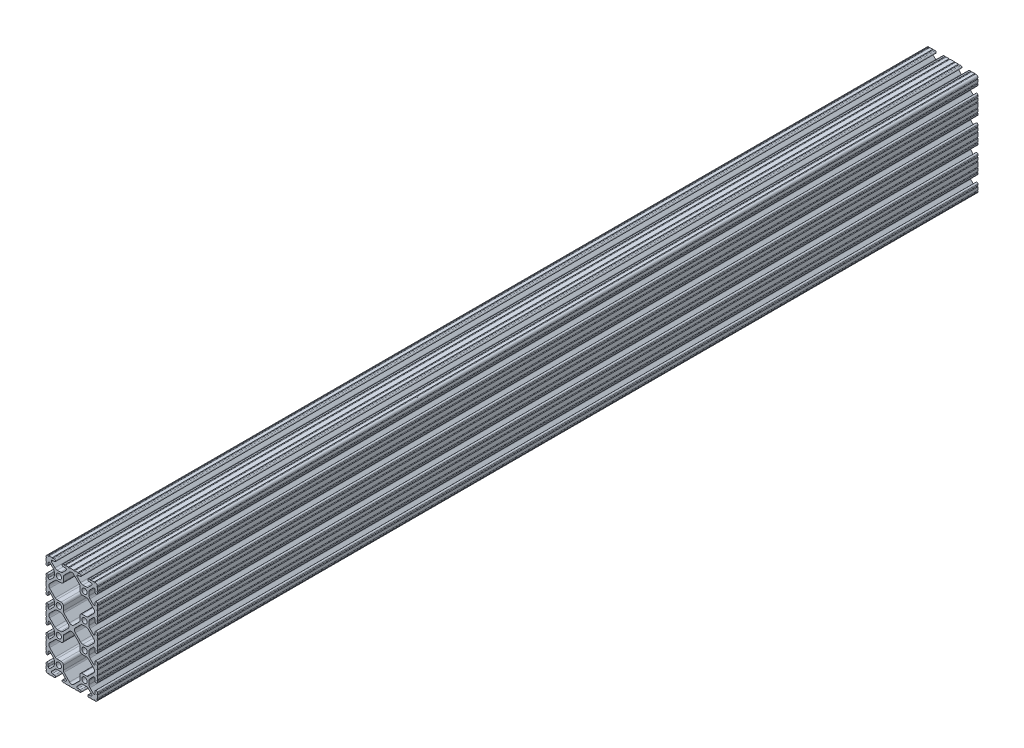
from build123d import *

# Parameters (mm, degrees)
SKETCH1_R      = 2.6035
EXTRUDE1_DEPTH = 871.728


with BuildPart() as part:
    # Sketch1 → Extrude1 (new body)
    with BuildSketch(Plane.XY):
        with BuildLine():
            Line((-12.699984366, 40.2336), (-12.699984366, 35.9664))
            ThreePointArc((-12.699984366, 35.9664), (-12.192, 35.458392183), (-12.7, 34.9504))
            Line((-12.7, 34.9504), (-12.7, 32.004))
            ThreePointArc((-12.7, 32.004), (-12.192, 31.496), (-12.7, 30.988))
            Line((-12.7, 30.988), (-12.7, 29.7434))
            ThreePointArc((-12.7, 29.7434), (-11.5951, 28.6385), (-10.4902, 29.7434))
            Line((-10.4902, 29.7434), (-10.4902, 31.874256981))
            ThreePointArc((-10.4902, 31.874256981), (-9.863010627, 32.812916821), (-8.755786031, 32.592683991))
            Line((-8.755786031, 32.592683991), (-5.425756348, 29.262714761))
            ThreePointArc((-5.425756348, 29.262714761), (-4.737487999, 28.232663563), (-4.4958, 27.017630353))
            Line((-4.4958, 27.017630353), (-4.4958, 23.782369647))
            ThreePointArc((-4.4958, 23.782369647), (-4.737487999, 22.567336437), (-5.425756348, 21.537285239))
            Line((-5.425756348, 21.537285239), (-8.755786031, 18.207316009))
            ThreePointArc((-8.755786031, 18.207316009), (-9.863010627, 17.987083179), (-10.4902, 18.925743019))
            Line((-10.4902, 18.925743019), (-10.4902, 21.0566))
            ThreePointArc((-10.4902, 21.0566), (-11.5951, 22.1615), (-12.7, 21.0566))
            Line((-12.7, 21.0566), (-12.7, 19.812))
            ThreePointArc((-12.7, 19.812), (-12.192, 19.304), (-12.7, 18.796))
            Line((-12.7, 18.796), (-12.7, 15.8496))
            ThreePointArc((-12.7, 15.8496), (-12.192, 15.341607817), (-12.699984366, 14.8336))
            Line((-12.699984366, 14.8336), (-12.699984366, 10.5664))
            ThreePointArc((-12.699984366, 10.5664), (-12.192, 10.0584), (-12.699984366, 9.5504))
            Line((-12.699984366, 9.5504), (-12.699984366, 6.604))
            ThreePointArc((-12.699984366, 6.604), (-12.192, 6.095992183), (-12.7, 5.588))
            Line((-12.7, 5.588), (-12.7, 4.3434))
            ThreePointArc((-12.7, 4.3434), (-11.5951, 3.2385), (-10.4902, 4.3434))
            Line((-10.4902, 4.3434), (-10.4902, 6.474256981))
            ThreePointArc((-10.4902, 6.474256981), (-9.863010627, 7.412916821), (-8.755786031, 7.192683991))
            Line((-8.755786031, 7.192683991), (-5.425756348, 3.862714761))
            ThreePointArc((-5.425756348, 3.862714761), (-4.737487999, 2.832663563), (-4.4958, 1.617630353))
            Line((-4.4958, 1.617630353), (-4.4958, -1.617630353))
            ThreePointArc((-4.4958, -1.617630353), (-4.737487999, -2.832663563), (-5.425756348, -3.862714761))
            Line((-5.425756348, -3.862714761), (-8.755786031, -7.192683991))
            ThreePointArc((-8.755786031, -7.192683991), (-9.863010627, -7.412916821), (-10.4902, -6.474256981))
            Line((-10.4902, -6.474256981), (-10.4902, -4.3434))
            ThreePointArc((-10.4902, -4.3434), (-11.5951, -3.2385), (-12.7, -4.3434))
            Line((-12.7, -4.3434), (-12.7, -5.588))
            ThreePointArc((-12.7, -5.588), (-12.192, -6.096), (-12.7, -6.604))
            Line((-12.7, -6.604), (-12.7, -9.5504))
            ThreePointArc((-12.7, -9.5504), (-12.192000007, -10.058315768), (-12.699831537, -10.566399972))
            ThreePointArc((-12.699831537, -10.566399972), (-12.082506882, -12.082506882), (-10.566399972, -12.699831537))
            ThreePointArc((-10.566399972, -12.699831537), (-10.058315768, -12.192000007), (-9.5504, -12.7))
            Line((-9.5504, -12.7), (-6.604, -12.7))
            ThreePointArc((-6.604, -12.7), (-6.096, -12.192), (-5.588, -12.7))
            Line((-5.588, -12.7), (-4.3434, -12.7))
            ThreePointArc((-4.3434, -12.7), (-3.2385, -11.5951), (-4.3434, -10.4902))
            Line((-4.3434, -10.4902), (-6.474256981, -10.4902))
            ThreePointArc((-6.474256981, -10.4902), (-7.412916821, -9.863010627), (-7.192683991, -8.755786031))
            Line((-7.192683991, -8.755786031), (-3.862714761, -5.425756348))
            ThreePointArc((-3.862714761, -5.425756348), (-2.832663563, -4.737487999), (-1.617630353, -4.4958))
            Line((-1.617630353, -4.4958), (1.617630353, -4.4958))
            ThreePointArc((1.617630353, -4.4958), (2.832663563, -4.737487999), (3.862714761, -5.425756348))
            Line((3.862714761, -5.425756348), (7.192683991, -8.755786031))
            ThreePointArc((7.192683991, -8.755786031), (7.412916821, -9.863010627), (6.474256981, -10.4902))
            Line((6.474256981, -10.4902), (4.3434, -10.4902))
            ThreePointArc((4.3434, -10.4902), (3.2385, -11.5951), (4.3434, -12.7))
            Line((4.3434, -12.7), (5.588, -12.7))
            ThreePointArc((5.588, -12.7), (6.096, -12.192), (6.604, -12.7))
            Line((6.604, -12.7), (9.5504, -12.7))
            ThreePointArc((9.5504, -12.7), (10.0584, -12.192), (10.5664, -12.7))
            Line((10.5664, -12.7), (14.8336, -12.7))
            ThreePointArc((14.8336, -12.7), (15.3416, -12.192), (15.8496, -12.7))
            Line((15.8496, -12.7), (18.796, -12.7))
            ThreePointArc((18.796, -12.7), (19.304, -12.192), (19.812, -12.7))
            Line((19.812, -12.7), (21.0566, -12.7))
            ThreePointArc((21.0566, -12.7), (22.1615, -11.5951), (21.0566, -10.4902))
            Line((21.0566, -10.4902), (18.925743019, -10.4902))
            ThreePointArc((18.925743019, -10.4902), (17.987083179, -9.863010627), (18.207316009, -8.755786031))
            Line((18.207316009, -8.755786031), (21.537285239, -5.425756348))
            ThreePointArc((21.537285239, -5.425756348), (22.567336437, -4.737487999), (23.782369647, -4.4958))
            Line((23.782369647, -4.4958), (27.017630353, -4.4958))
            ThreePointArc((27.017630353, -4.4958), (28.232663563, -4.737487999), (29.262714761, -5.425756348))
            Line((29.262714761, -5.425756348), (32.592683991, -8.755786031))
            ThreePointArc((32.592683991, -8.755786031), (32.812916821, -9.863010627), (31.874256981, -10.4902))
            Line((31.874256981, -10.4902), (29.7434, -10.4902))
            ThreePointArc((29.7434, -10.4902), (28.6385, -11.5951), (29.7434, -12.7))
            Line((29.7434, -12.7), (30.988, -12.7))
            ThreePointArc((30.988, -12.7), (31.496, -12.192), (32.004, -12.7))
            Line((32.004, -12.7), (34.9504, -12.7))
            ThreePointArc((34.9504, -12.7), (35.458315768, -12.192000007), (35.966399972, -12.699831537))
            ThreePointArc((35.966399972, -12.699831537), (37.482506882, -12.082506882), (38.099831537, -10.566399972))
            ThreePointArc((38.099831537, -10.566399972), (37.592000007, -10.058315768), (38.1, -9.5504))
            Line((38.1, -9.5504), (38.1, -6.604))
            ThreePointArc((38.1, -6.604), (37.592, -6.096), (38.1, -5.588))
            Line((38.1, -5.588), (38.1, -4.3434))
            ThreePointArc((38.1, -4.3434), (36.9951, -3.2385), (35.8902, -4.3434))
            Line((35.8902, -4.3434), (35.8902, -6.474256981))
            ThreePointArc((35.8902, -6.474256981), (35.263010627, -7.412916821), (34.155786031, -7.192683991))
            Line((34.155786031, -7.192683991), (30.825756348, -3.862714761))
            ThreePointArc((30.825756348, -3.862714761), (30.137487999, -2.832663563), (29.8958, -1.617630353))
            Line((29.8958, -1.617630353), (29.8958, 1.617630353))
            ThreePointArc((29.8958, 1.617630353), (30.137487999, 2.832663563), (30.825756348, 3.862714761))
            Line((30.825756348, 3.862714761), (34.155786031, 7.192683991))
            ThreePointArc((34.155786031, 7.192683991), (35.263010627, 7.412916821), (35.8902, 6.474256981))
            Line((35.8902, 6.474256981), (35.8902, 4.3434))
            ThreePointArc((35.8902, 4.3434), (36.9951, 3.2385), (38.1, 4.3434))
            Line((38.1, 4.3434), (38.1, 5.588))
            ThreePointArc((38.1, 5.588), (37.592, 6.096), (38.1, 6.604))
            Line((38.1, 6.604), (38.1, 9.5504))
            ThreePointArc((38.1, 9.5504), (37.592, 10.058392183), (38.099984366, 10.5664))
            Line((38.099984366, 10.5664), (38.099984366, 14.8336))
            ThreePointArc((38.099984366, 14.8336), (37.592, 15.3416), (38.099984366, 15.8496))
            Line((38.099984366, 15.8496), (38.099984366, 18.796))
            ThreePointArc((38.099984366, 18.796), (37.592, 19.304007817), (38.1, 19.812))
            Line((38.1, 19.812), (38.1, 21.0566))
            ThreePointArc((38.1, 21.0566), (36.9951, 22.1615), (35.8902, 21.0566))
            Line((35.8902, 21.0566), (35.8902, 18.925743019))
            ThreePointArc((35.8902, 18.925743019), (35.263010627, 17.987083179), (34.155786031, 18.207316009))
            Line((34.155786031, 18.207316009), (30.825756348, 21.537285239))
            ThreePointArc((30.825756348, 21.537285239), (30.137487999, 22.567336437), (29.8958, 23.782369647))
            Line((29.8958, 23.782369647), (29.8958, 27.017630353))
            ThreePointArc((29.8958, 27.017630353), (30.137487999, 28.232663563), (30.825756348, 29.262714761))
            Line((30.825756348, 29.262714761), (34.155786031, 32.592683991))
            ThreePointArc((34.155786031, 32.592683991), (35.263010627, 32.812916821), (35.8902, 31.874256981))
            Line((35.8902, 31.874256981), (35.8902, 29.7434))
            ThreePointArc((35.8902, 29.7434), (36.9951, 28.6385), (38.1, 29.7434))
            Line((38.1, 29.7434), (38.1, 30.988))
            ThreePointArc((38.1, 30.988), (37.592, 31.495992183), (38.099984366, 32.004))
            Line((38.099984366, 32.004), (38.099984366, 34.9504))
            ThreePointArc((38.099984366, 34.9504), (37.592, 35.4584), (38.099984366, 35.9664))
            Line((38.099984366, 35.9664), (38.099984366, 40.2336))
            ThreePointArc((38.099984366, 40.2336), (37.592, 40.7416), (38.099984366, 41.2496))
            Line((38.099984366, 41.2496), (38.099984366, 44.196))
            ThreePointArc((38.099984366, 44.196), (37.592, 44.704007817), (38.1, 45.212))
            Line((38.1, 45.212), (38.1, 46.4566))
            ThreePointArc((38.1, 46.4566), (36.9951, 47.5615), (35.8902, 46.4566))
            Line((35.8902, 46.4566), (35.8902, 44.325743019))
            ThreePointArc((35.8902, 44.325743019), (35.263010627, 43.387083179), (34.155786031, 43.607316009))
            Line((34.155786031, 43.607316009), (30.825756348, 46.937285239))
            ThreePointArc((30.825756348, 46.937285239), (30.137487999, 47.967336437), (29.8958, 49.182369647))
            Line((29.8958, 49.182369647), (29.8958, 52.417630353))
            ThreePointArc((29.8958, 52.417630353), (30.137487999, 53.632663563), (30.825756348, 54.662714761))
            Line((30.825756348, 54.662714761), (34.155786031, 57.992683991))
            ThreePointArc((34.155786031, 57.992683991), (35.263010627, 58.212916821), (35.8902, 57.274256981))
            Line((35.8902, 57.274256981), (35.8902, 55.1434))
            ThreePointArc((35.8902, 55.1434), (36.9951, 54.0385), (38.1, 55.1434))
            Line((38.1, 55.1434), (38.1, 56.388))
            ThreePointArc((38.1, 56.388), (37.592, 56.896), (38.1, 57.404))
            Line((38.1, 57.404), (38.1, 60.3504))
            ThreePointArc((38.1, 60.3504), (37.592, 60.858392183), (38.099984366, 61.3664))
            Line((38.099984366, 61.3664), (38.099984366, 65.6336))
            ThreePointArc((38.099984366, 65.6336), (37.592, 66.141607817), (38.1, 66.6496))
            Line((38.1, 66.6496), (38.1, 69.596))
            ThreePointArc((38.1, 69.596), (37.592, 70.104), (38.1, 70.612))
            Line((38.1, 70.612), (38.1, 71.8566))
            ThreePointArc((38.1, 71.8566), (36.9951, 72.9615), (35.8902, 71.8566))
            Line((35.8902, 71.8566), (35.8902, 69.725743019))
            ThreePointArc((35.8902, 69.725743019), (35.263010627, 68.787083179), (34.155786031, 69.007316009))
            Line((34.155786031, 69.007316009), (30.825756348, 72.337285239))
            ThreePointArc((30.825756348, 72.337285239), (30.137487999, 73.367336437), (29.8958, 74.582369647))
            Line((29.8958, 74.582369647), (29.8958, 77.817630353))
            ThreePointArc((29.8958, 77.817630353), (30.137487999, 79.032663563), (30.825756348, 80.062714761))
            Line((30.825756348, 80.062714761), (34.155786031, 83.392683991))
            ThreePointArc((34.155786031, 83.392683991), (35.263010627, 83.612916821), (35.8902, 82.674256981))
            Line((35.8902, 82.674256981), (35.8902, 80.5434))
            ThreePointArc((35.8902, 80.5434), (36.9951, 79.4385), (38.1, 80.5434))
            Line((38.1, 80.5434), (38.1, 81.788))
            ThreePointArc((38.1, 81.788), (37.592, 82.296), (38.1, 82.804))
            Line((38.1, 82.804), (38.1, 85.7504))
            ThreePointArc((38.1, 85.7504), (37.592000007, 86.258315768), (38.099831537, 86.766399972))
            ThreePointArc((38.099831537, 86.766399972), (37.482506882, 88.282506882), (35.966399972, 88.899831537))
            ThreePointArc((35.966399972, 88.899831537), (35.458315768, 88.392000007), (34.9504, 88.9))
            Line((34.9504, 88.9), (32.004, 88.9))
            ThreePointArc((32.004, 88.9), (31.496, 88.392), (30.988, 88.9))
            Line((30.988, 88.9), (29.7434, 88.9))
            ThreePointArc((29.7434, 88.9), (28.6385, 87.7951), (29.7434, 86.6902))
            Line((29.7434, 86.6902), (31.874256981, 86.6902))
            ThreePointArc((31.874256981, 86.6902), (32.812916821, 86.063010627), (32.592683991, 84.955786031))
            Line((32.592683991, 84.955786031), (29.262714761, 81.625756348))
            ThreePointArc((29.262714761, 81.625756348), (28.232663563, 80.937487999), (27.017630353, 80.6958))
            Line((27.017630353, 80.6958), (23.782369647, 80.6958))
            ThreePointArc((23.782369647, 80.6958), (22.567336437, 80.937487999), (21.537285239, 81.625756348))
            Line((21.537285239, 81.625756348), (18.207316009, 84.955786031))
            ThreePointArc((18.207316009, 84.955786031), (17.987083179, 86.063010627), (18.925743019, 86.6902))
            Line((18.925743019, 86.6902), (21.0566, 86.6902))
            ThreePointArc((21.0566, 86.6902), (22.1615, 87.7951), (21.0566, 88.9))
            Line((21.0566, 88.9), (19.812, 88.9))
            ThreePointArc((19.812, 88.9), (19.304, 88.392), (18.796, 88.9))
            Line((18.796, 88.9), (15.8496, 88.9))
            ThreePointArc((15.8496, 88.9), (15.3416, 88.392), (14.8336, 88.9))
            Line((14.8336, 88.9), (10.5664, 88.9))
            ThreePointArc((10.5664, 88.9), (10.0584, 88.392), (9.5504, 88.9))
            Line((9.5504, 88.9), (6.604, 88.9))
            ThreePointArc((6.604, 88.9), (6.096, 88.392), (5.588, 88.9))
            Line((5.588, 88.9), (4.3434, 88.9))
            ThreePointArc((4.3434, 88.9), (3.2385, 87.7951), (4.3434, 86.6902))
            Line((4.3434, 86.6902), (6.474256981, 86.6902))
            ThreePointArc((6.474256981, 86.6902), (7.412916821, 86.063010627), (7.192683991, 84.955786031))
            Line((7.192683991, 84.955786031), (3.862714761, 81.625756348))
            ThreePointArc((3.862714761, 81.625756348), (2.832663563, 80.937487999), (1.617630353, 80.6958))
            Line((1.617630353, 80.6958), (-1.617630353, 80.6958))
            ThreePointArc((-1.617630353, 80.6958), (-2.832663563, 80.937487999), (-3.862714761, 81.625756348))
            Line((-3.862714761, 81.625756348), (-7.192683991, 84.955786031))
            ThreePointArc((-7.192683991, 84.955786031), (-7.412916821, 86.063010627), (-6.474256981, 86.6902))
            Line((-6.474256981, 86.6902), (-4.3434, 86.6902))
            ThreePointArc((-4.3434, 86.6902), (-3.2385, 87.7951), (-4.3434, 88.9))
            Line((-4.3434, 88.9), (-5.588, 88.9))
            ThreePointArc((-5.588, 88.9), (-6.096, 88.392), (-6.604, 88.9))
            Line((-6.604, 88.9), (-9.5504, 88.9))
            ThreePointArc((-9.5504, 88.9), (-10.058315768, 88.392000007), (-10.566399972, 88.899831537))
            ThreePointArc((-10.566399972, 88.899831537), (-12.082506882, 88.282506882), (-12.699831537, 86.766399972))
            ThreePointArc((-12.699831537, 86.766399972), (-12.192000007, 86.258315768), (-12.7, 85.7504))
            Line((-12.7, 85.7504), (-12.7, 82.804))
            ThreePointArc((-12.7, 82.804), (-12.192, 82.296), (-12.7, 81.788))
            Line((-12.7, 81.788), (-12.7, 80.5434))
            ThreePointArc((-12.7, 80.5434), (-11.5951, 79.4385), (-10.4902, 80.5434))
            Line((-10.4902, 80.5434), (-10.4902, 82.674256981))
            ThreePointArc((-10.4902, 82.674256981), (-9.863010627, 83.612916821), (-8.755786031, 83.392683991))
            Line((-8.755786031, 83.392683991), (-5.425756348, 80.062714761))
            ThreePointArc((-5.425756348, 80.062714761), (-4.737487999, 79.032663563), (-4.4958, 77.817630353))
            Line((-4.4958, 77.817630353), (-4.4958, 74.582369647))
            ThreePointArc((-4.4958, 74.582369647), (-4.737487999, 73.367336437), (-5.425756348, 72.337285239))
            Line((-5.425756348, 72.337285239), (-8.755786031, 69.007316009))
            ThreePointArc((-8.755786031, 69.007316009), (-9.863010627, 68.787083179), (-10.4902, 69.725743019))
            Line((-10.4902, 69.725743019), (-10.4902, 71.8566))
            ThreePointArc((-10.4902, 71.8566), (-11.5951, 72.9615), (-12.7, 71.8566))
            Line((-12.7, 71.8566), (-12.7, 70.612))
            ThreePointArc((-12.7, 70.612), (-12.192, 70.104), (-12.7, 69.596))
            Line((-12.7, 69.596), (-12.7, 66.6496))
            ThreePointArc((-12.7, 66.6496), (-12.192, 66.141607817), (-12.699984366, 65.6336))
            Line((-12.699984366, 65.6336), (-12.699984366, 61.3664))
            ThreePointArc((-12.699984366, 61.3664), (-12.192, 60.858392183), (-12.7, 60.3504))
            Line((-12.7, 60.3504), (-12.7, 57.404))
            ThreePointArc((-12.7, 57.404), (-12.192, 56.896), (-12.7, 56.388))
            Line((-12.7, 56.388), (-12.7, 55.1434))
            ThreePointArc((-12.7, 55.1434), (-11.5951, 54.0385), (-10.4902, 55.1434))
            Line((-10.4902, 55.1434), (-10.4902, 57.274256981))
            ThreePointArc((-10.4902, 57.274256981), (-9.863010627, 58.212916821), (-8.755786031, 57.992683991))
            Line((-8.755786031, 57.992683991), (-5.425756348, 54.662714761))
            ThreePointArc((-5.425756348, 54.662714761), (-4.737487999, 53.632663563), (-4.4958, 52.417630353))
            Line((-4.4958, 52.417630353), (-4.4958, 49.182369647))
            ThreePointArc((-4.4958, 49.182369647), (-4.737487999, 47.967336437), (-5.425756348, 46.937285239))
            Line((-5.425756348, 46.937285239), (-8.755786031, 43.607316009))
            ThreePointArc((-8.755786031, 43.607316009), (-9.863010627, 43.387083179), (-10.4902, 44.325743019))
            Line((-10.4902, 44.325743019), (-10.4902, 46.4566))
            ThreePointArc((-10.4902, 46.4566), (-11.5951, 47.5615), (-12.7, 46.4566))
            Line((-12.7, 46.4566), (-12.7, 45.212))
            ThreePointArc((-12.7, 45.212), (-12.192, 44.704), (-12.7, 44.196))
            Line((-12.7, 44.196), (-12.7, 41.2496))
            ThreePointArc((-12.7, 41.2496), (-12.192, 40.741607817), (-12.699984366, 40.2336))
        make_face()
        with Locations((25.4, 76.2)):
            Circle(SKETCH1_R, mode=Mode.SUBTRACT)
        with Locations((0, 76.2)):
            Circle(SKETCH1_R, mode=Mode.SUBTRACT)
        with Locations((25.4, 50.8)):
            Circle(SKETCH1_R, mode=Mode.SUBTRACT)
        with Locations((0, 50.8)):
            Circle(SKETCH1_R, mode=Mode.SUBTRACT)
        with Locations((25.4, 0)):
            Circle(SKETCH1_R, mode=Mode.SUBTRACT)
        Circle(SKETCH1_R, mode=Mode.SUBTRACT)
        with Locations((25.4, 25.4)):
            Circle(SKETCH1_R, mode=Mode.SUBTRACT)
        with Locations((0, 25.4)):
            Circle(SKETCH1_R, mode=Mode.SUBTRACT)
        with BuildLine():
            Line((2.286, 55.2958), (-2.018378203, 55.2958))
            ThreePointArc((-2.018378203, 55.2958), (-2.864022786, 55.464007171), (-3.580928584, 55.943021252))
            Line((-3.580928584, 55.943021252), (-9.072529371, 61.434522344))
            ThreePointArc((-9.072529371, 61.434522344), (-9.928089211, 63.5), (-9.072529371, 65.565477656))
            Line((-9.072529371, 65.565477656), (-3.580928584, 71.056978748))
            ThreePointArc((-3.580928584, 71.056978748), (-2.864022786, 71.535992829), (-2.018378203, 71.7042))
            Line((-2.018378203, 71.7042), (2.286, 71.7042))
            ThreePointArc((2.286, 71.7042), (3.848564565, 72.351435435), (4.4958, 73.914))
            Line((4.4958, 73.914), (4.4958, 78.218378203))
            ThreePointArc((4.4958, 78.218378203), (4.664007171, 79.064022786), (5.143021252, 79.780928584))
            Line((5.143021252, 79.780928584), (10.634522344, 85.272529371))
            ThreePointArc((10.634522344, 85.272529371), (12.7, 86.128089211), (14.765477656, 85.272529371))
            Line((14.765477656, 85.272529371), (20.256978748, 79.780928584))
            ThreePointArc((20.256978748, 79.780928584), (20.735992829, 79.064022786), (20.9042, 78.218378203))
            Line((20.9042, 78.218378203), (20.9042, 73.914))
            ThreePointArc((20.9042, 73.914), (21.551435435, 72.351435435), (23.114, 71.7042))
            Line((23.114, 71.7042), (27.418378203, 71.7042))
            ThreePointArc((27.418378203, 71.7042), (28.264022786, 71.535992829), (28.980928584, 71.056978748))
            Line((28.980928584, 71.056978748), (34.472529371, 65.565477656))
            ThreePointArc((34.472529371, 65.565477656), (35.328089211, 63.5), (34.472529371, 61.434522344))
            Line((34.472529371, 61.434522344), (28.980928584, 55.943021252))
            ThreePointArc((28.980928584, 55.943021252), (28.264022786, 55.464007171), (27.418378203, 55.2958))
            Line((27.418378203, 55.2958), (23.114, 55.2958))
            ThreePointArc((23.114, 55.2958), (21.551435435, 54.648564565), (20.9042, 53.086))
            Line((20.9042, 53.086), (20.9042, 48.781621797))
            ThreePointArc((20.9042, 48.781621797), (20.735992829, 47.935977214), (20.256978748, 47.219071416))
            Line((20.256978748, 47.219071416), (14.765477656, 41.727470629))
            ThreePointArc((14.765477656, 41.727470629), (12.7, 40.871910789), (10.634522344, 41.727470629))
            Line((10.634522344, 41.727470629), (5.143021252, 47.219071416))
            ThreePointArc((5.143021252, 47.219071416), (4.664007171, 47.935977214), (4.4958, 48.781621797))
            Line((4.4958, 48.781621797), (4.4958, 53.086))
            ThreePointArc((4.4958, 53.086), (3.848564565, 54.648564565), (2.286, 55.2958))
        make_face(mode=Mode.SUBTRACT)
        with BuildLine():
            Line((4.4958, 23.114), (4.4958, 27.418378203))
            ThreePointArc((4.4958, 27.418378203), (4.664007171, 28.264022786), (5.143021252, 28.980928584))
            Line((5.143021252, 28.980928584), (10.634522344, 34.472529371))
            ThreePointArc((10.634522344, 34.472529371), (12.7, 35.328089211), (14.765477656, 34.472529371))
            Line((14.765477656, 34.472529371), (20.256978748, 28.980928584))
            ThreePointArc((20.256978748, 28.980928584), (20.735992829, 28.264022786), (20.9042, 27.418378203))
            Line((20.9042, 27.418378203), (20.9042, 23.114))
            ThreePointArc((20.9042, 23.114), (21.551435435, 21.551435435), (23.114, 20.9042))
            Line((23.114, 20.9042), (27.418378203, 20.9042))
            ThreePointArc((27.418378203, 20.9042), (28.264022786, 20.735992829), (28.980928584, 20.256978748))
            Line((28.980928584, 20.256978748), (34.472529371, 14.765477656))
            ThreePointArc((34.472529371, 14.765477656), (35.328089211, 12.7), (34.472529371, 10.634522344))
            Line((34.472529371, 10.634522344), (28.980928584, 5.143021252))
            ThreePointArc((28.980928584, 5.143021252), (28.264022786, 4.664007171), (27.418378203, 4.4958))
            Line((27.418378203, 4.4958), (23.114, 4.4958))
            ThreePointArc((23.114, 4.4958), (21.551435435, 3.848564565), (20.9042, 2.286))
            Line((20.9042, 2.286), (20.9042, -2.018378203))
            ThreePointArc((20.9042, -2.018378203), (20.735992829, -2.864022786), (20.256978748, -3.580928584))
            Line((20.256978748, -3.580928584), (14.765477656, -9.072529371))
            ThreePointArc((14.765477656, -9.072529371), (12.7, -9.928089211), (10.634522344, -9.072529371))
            Line((10.634522344, -9.072529371), (5.143021252, -3.580928584))
            ThreePointArc((5.143021252, -3.580928584), (4.664007171, -2.864022786), (4.4958, -2.018378203))
            Line((4.4958, -2.018378203), (4.4958, 2.286))
            ThreePointArc((4.4958, 2.286), (3.848564565, 3.848564565), (2.286, 4.4958))
            Line((2.286, 4.4958), (-2.018378203, 4.4958))
            ThreePointArc((-2.018378203, 4.4958), (-2.864022786, 4.664007171), (-3.580928584, 5.143021252))
            Line((-3.580928584, 5.143021252), (-9.072529371, 10.634522344))
            ThreePointArc((-9.072529371, 10.634522344), (-9.928089211, 12.7), (-9.072529371, 14.765477656))
            Line((-9.072529371, 14.765477656), (-3.580928584, 20.256978748))
            ThreePointArc((-3.580928584, 20.256978748), (-2.864022786, 20.735992829), (-2.018378203, 20.9042))
            Line((-2.018378203, 20.9042), (2.286, 20.9042))
            ThreePointArc((2.286, 20.9042), (3.848564565, 21.551435435), (4.4958, 23.114))
        make_face(mode=Mode.SUBTRACT)
        with BuildLine():
            Line((27.018584404, 29.8958), (23.782369647, 29.8958))
            ThreePointArc((23.782369647, 29.8958), (22.567336437, 30.137487999), (21.537285239, 30.825756348))
            Line((21.537285239, 30.825756348), (16.328576307, 36.03455984))
            ThreePointArc((16.328576307, 36.03455984), (15.473053963, 38.1), (16.328576307, 40.16544016))
            Line((16.328576307, 40.16544016), (21.537285239, 45.374243652))
            ThreePointArc((21.537285239, 45.374243652), (22.567336437, 46.062512001), (23.782369647, 46.3042))
            Line((23.782369647, 46.3042), (27.018584404, 46.3042))
            ThreePointArc((27.018584404, 46.3042), (28.233590989, 46.06252303), (29.263628056, 45.374284409))
            Line((29.263628056, 45.374284409), (34.472529371, 40.165477656))
            ThreePointArc((34.472529371, 40.165477656), (35.328089211, 38.1), (34.472529371, 36.034522344))
            Line((34.472529371, 36.034522344), (29.263628056, 30.825715591))
            ThreePointArc((29.263628056, 30.825715591), (28.233590989, 30.13747697), (27.018584404, 29.8958))
        make_face(mode=Mode.SUBTRACT)
        with BuildLine():
            Line((1.617630353, 29.8958), (-1.618584404, 29.8958))
            ThreePointArc((-1.618584404, 29.8958), (-2.833590989, 30.13747697), (-3.863628056, 30.825715591))
            Line((-3.863628056, 30.825715591), (-9.072529371, 36.034522344))
            ThreePointArc((-9.072529371, 36.034522344), (-9.928089211, 38.1), (-9.072529371, 40.165477656))
            Line((-9.072529371, 40.165477656), (-3.863628056, 45.374284409))
            ThreePointArc((-3.863628056, 45.374284409), (-2.833590989, 46.06252303), (-1.618584404, 46.3042))
            Line((-1.618584404, 46.3042), (1.617630353, 46.3042))
            ThreePointArc((1.617630353, 46.3042), (2.832663563, 46.062512001), (3.862714761, 45.374243652))
            Line((3.862714761, 45.374243652), (9.071423693, 40.16544016))
            ThreePointArc((9.071423693, 40.16544016), (9.926946037, 38.1), (9.071423693, 36.03455984))
            Line((9.071423693, 36.03455984), (3.862714761, 30.825756348))
            ThreePointArc((3.862714761, 30.825756348), (2.832663563, 30.137487999), (1.617630353, 29.8958))
        make_face(mode=Mode.SUBTRACT)
    extrude(amount=-EXTRUDE1_DEPTH)


solid = part.part
